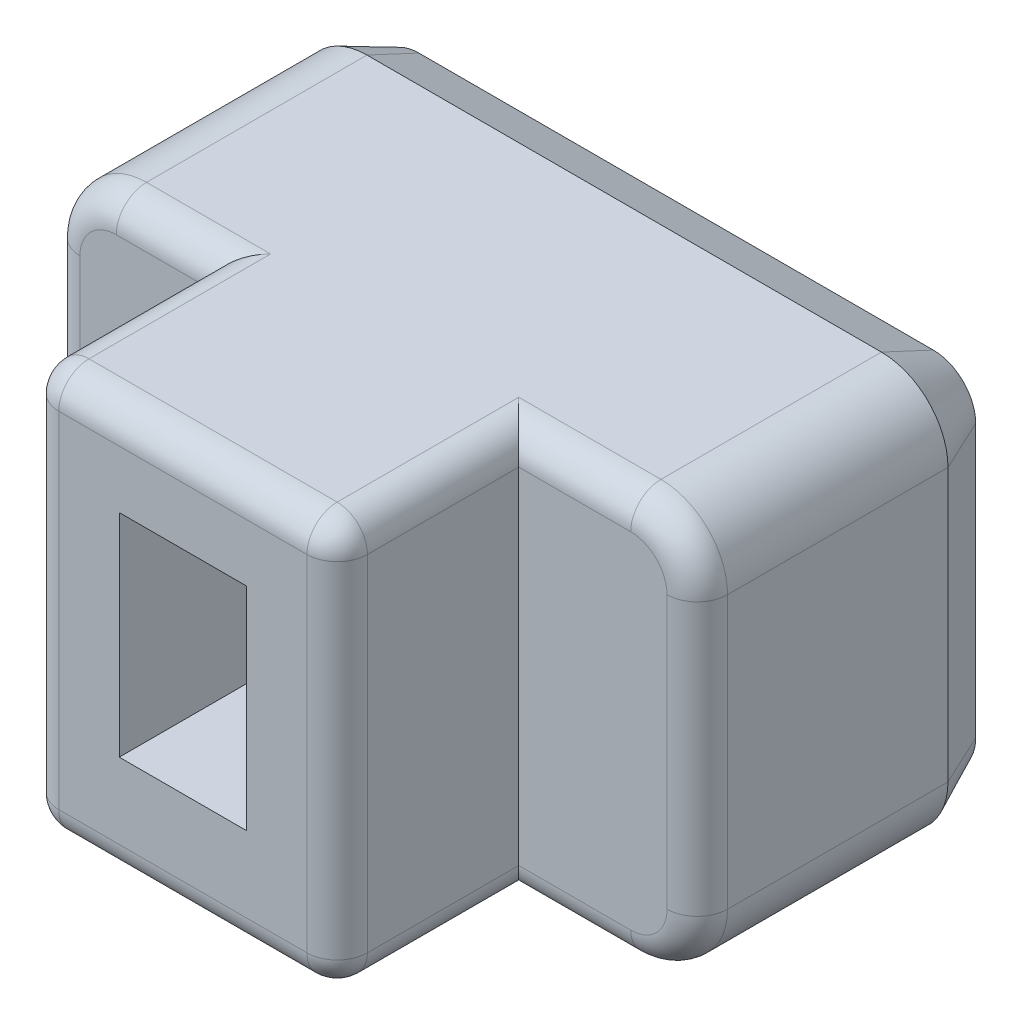
from build123d import *

# Parameters (mm, degrees)
BOSS_EXTRU_1_DEPTH      = 8
ESQUISSE3_W             = 2.1
ESQUISSE3_H             = 3.5
ENL_V_MAT_EXTRU_1_DEPTH = 3
ESQUISSE4_OUTSIDE_W     = 15.69
ESQUISSE4_OUTSIDE_H     = 11.69
ESQUISSE4_OUTSIDE_W_2   = 5.1
ESQUISSE4_OUTSIDE_H_2   = 6.7
ENL_V_MAT_EXTRU_2_DEPTH = 3
CONG_1_R                = 0.5
CHANFREIN1_SIZE         = 0.4
CHANFREIN1_SIZE2        = 0.857802768
ENL_V_MAT_EXTRU_3_DEPTH = 0.3
BOSS_EXTRU_2_START      = -0.2
BOSS_EXTRU_2_DEPTH      = 0.2
BOSS_EXTRU_2_2_DEPTH    = 0.2
BOSS_EXTRU_2_3_DEPTH    = 0.2


with BuildPart() as part:
    # Esquisse2 → Boss.-Extru.1 (new body)
    with BuildSketch(Plane.XY):
        with BuildLine():
            Line((1.1, 0), (9.6, 0))
            ThreePointArc((9.6, 0), (10.377817459, 0.322182541), (10.7, 1.1))
            Line((10.7, 1.1), (10.7, 5.6))
            ThreePointArc((10.7, 5.6), (10.377817459, 6.377817459), (9.6, 6.7))
            Line((9.6, 6.7), (1.1, 6.7))
            ThreePointArc((1.1, 6.7), (0.322182541, 6.377817459), (0, 5.6))
            Line((0, 5.6), (0, 1.1))
            ThreePointArc((0, 1.1), (0.322182541, 0.322182541), (1.1, 0))
        make_face()
    extrude(amount=BOSS_EXTRU_1_DEPTH)

    # Esquisse3 → Enlèv. mat.-Extru.1 (cut)
    with BuildSketch(Plane.XY.offset(8)):
        with Locations((5.2, 3.5)):
            Rectangle(ESQUISSE3_W, ESQUISSE3_H)
    extrude(amount=-ENL_V_MAT_EXTRU_1_DEPTH, mode=Mode.SUBTRACT)

    # Esquisse4 outside → Enlèv. mat.-Extru.2 (cut)
    with BuildSketch(Plane.XY.offset(8)):
        with Locations((5.35, 3.35)):
            Rectangle(ESQUISSE4_OUTSIDE_W, ESQUISSE4_OUTSIDE_H)
        with Locations((5.2, 3.35)):
            Rectangle(ESQUISSE4_OUTSIDE_W_2, ESQUISSE4_OUTSIDE_H_2, mode=Mode.SUBTRACT)
    extrude(amount=-ENL_V_MAT_EXTRU_2_DEPTH, mode=Mode.SUBTRACT)

    # Congé1
    cong_1_edges = [part.edges().sort_by_distance(p)[0] for p in [
        (8.675, 0, 5),
        (10.377817459, 0.322182541, 5),
        (10.7, 3.35, 5),
        (10.377817459, 6.377817459, 5),
        (1.875, 6.7, 5),
        (0.322182541, 6.377817459, 5),
        (1.875, 0, 5),
        (0.322182541, 0.322182541, 5),
        (7.75, 6.7, 6.5),
        (2.65, 6.7, 6.5),
        (7.75, 0, 6.5),
        (2.65, 0, 6.5),
        (2.65, 3.35, 8),
        (5.2, 6.7, 8),
        (7.75, 3.35, 8),
        (5.2, 0, 8),
        (8.675, 6.7, 5),
        (0, 3.35, 5),
    ]]
    fillet(cong_1_edges, radius=CONG_1_R)

    # Chanfrein1
    chanfrein1_edges = [part.edges().sort_by_distance(p)[0] for p in [
        (5.35, 0, 0),
        (10.377817459, 0.322182541, 0),
        (0.322182541, 0.322182541, 0),
        (10.7, 3.35, 0),
        (0, 3.35, 0),
        (10.377817459, 6.377817459, 0),
        (0.322182541, 6.377817459, 0),
        (5.35, 6.7, 0),
    ]]
    chanfrein1_side = [part.faces().sort_by_distance(p)[0] for p in [
        (5.35, 3.35, 0),
    ]]
    chamfer(chanfrein1_edges, length=CHANFREIN1_SIZE, length2=CHANFREIN1_SIZE2, reference=chanfrein1_side[0])

    # Esquisse5 → Enlèv. mat.-Extru.3 (cut)
    # profile 1 of 3: a face of its own
    with BuildSketch(Plane.XY.offset(0.2)):
        Polygon((0.715926417, 1.356639893), (1.023618725, 1.356639893), (1.023618725, 2.997665534), (2.613362315, 2.997665534), (2.613362315, 1.356639893), (2.921054623, 1.356639893), (2.921054623, 5.356639893), (2.613362315, 5.356639893), (2.613362315, 3.407921944), (1.023618725, 3.407921944), (1.023618725, 5.356639893), (0.715926417, 5.356639893), align=None)
    # profile 2 of 3: a face of its own
    with BuildSketch(Plane.XY.offset(0.2)):
        with BuildLine():
            Line((3.690285392, 5.356639893), (3.690285392, 1.356639893))
            Line((3.690285392, 1.356639893), (4.333714879, 1.356639893))
            add(Edge.make_bspline(
                [(4.333714879, 1.356639893), (4.389810624, 1.357141838), (4.498033773, 1.358110221), (4.654382412, 1.364341846), (4.798763625, 1.37522077), (4.931297353, 1.391439913), (5.05211199, 1.410690919), (5.160998907, 1.435700169), (5.258032382, 1.464338702), (5.317069978, 1.489157436), (5.344932828, 1.500870662)],
                knots=[0, 0, 0, 0, 1.309437096, 2.526241632, 3.651891148, 4.688159363, 5.642426799, 6.506028034, 7.294918487, 8, 8, 8, 8], degree=3))
            add(Edge.make_bspline(
                [(5.344932828, 1.500870662), (5.38188335, 1.518625889), (5.455730178, 1.55411029), (5.55990193, 1.61936032), (5.657506628, 1.694584532), (5.748885002, 1.779084136), (5.834797423, 1.872181645), (5.914792343, 1.974572822), (5.987222614, 2.087038482), (6.05386307, 2.207963954), (6.112417599, 2.336840098), (6.16529012, 2.471568229), (6.207714223, 2.613073796), (6.244545367, 2.759934319), (6.271046471, 2.913499831), (6.291211889, 3.07281956), (6.303437472, 3.238126311), (6.304918167, 3.350209277), (6.305670007, 3.407120662)],
                knots=[0, 0, 0, 0, 0.871458102, 1.741637522, 2.608639908, 3.489143415, 4.385702305, 5.30052474, 6.249139159, 7.228044385, 8.234696997, 9.258075304, 10.303960817, 11.374580795, 12.476736741, 13.616170212, 14.789583668, 16, 16, 16, 16], degree=3))
            add(Edge.make_bspline(
                [(6.305670007, 3.407120662), (6.305100941, 3.456552211), (6.303980157, 3.553908278), (6.29373894, 3.697427236), (6.279248456, 3.836625171), (6.256319482, 3.971000141), (6.228554537, 4.101357333), (6.194129789, 4.227120318), (6.153366616, 4.348396397), (6.105893915, 4.464235934), (6.054393254, 4.574372206), (5.99807055, 4.677327835), (5.93803716, 4.772997212), (5.873803073, 4.861138999), (5.806689047, 4.94228008), (5.735736847, 5.016026855), (5.660523391, 5.081519527), (5.580851635, 5.140249605), (5.495522666, 5.191945236), (5.402285921, 5.236158637), (5.301256284, 5.27383734), (5.191980842, 5.303721936), (5.075109728, 5.328190228), (4.949989625, 5.344261422), (4.81681544, 5.355184163), (4.725298575, 5.356145726), (4.678266161, 5.356639893)],
                knots=[0, 0, 0, 0, 1.230996608, 2.424463549, 3.582262823, 4.715295747, 5.817862929, 6.900767493, 7.961040225, 9.002445687, 10.017227083, 10.987759982, 11.923516021, 12.82835125, 13.702260399, 14.544397218, 15.374225883, 16.18320695, 17.006933457, 17.854961706, 18.749590543, 19.688981151, 20.674020178, 21.721168008, 22.828861015, 24, 24, 24, 24], degree=3))
            Line((4.678266161, 5.356639893), (3.690285392, 5.356639893))
        make_face()
        with BuildLine():
            Line((3.997977699, 4.946383482), (4.356150776, 4.946383482))
            add(Edge.make_bspline(
                [(4.356150776, 4.946383482), (4.407703929, 4.946103684), (4.506561014, 4.945567148), (4.64870714, 4.940758435), (4.778580721, 4.932924833), (4.896481153, 4.921995766), (5.002039128, 4.907553668), (5.095572153, 4.891268748), (5.176717248, 4.871198539), (5.225405676, 4.853039307), (5.247977699, 4.844620662)],
                knots=[0, 0, 0, 0, 1.371756857, 2.630447951, 3.784000471, 4.833481419, 5.780309705, 6.618141895, 7.359368634, 8, 8, 8, 8], degree=3))
            add(Edge.make_bspline(
                [(5.247977699, 4.844620662), (5.276531751, 4.831753671), (5.333250547, 4.806195118), (5.414129236, 4.759140296), (5.489919044, 4.704791963), (5.561286335, 4.643144214), (5.627804713, 4.574210889), (5.689176463, 4.497521308), (5.747780631, 4.41504435), (5.79880364, 4.324176383), (5.846843562, 4.228477805), (5.886323265, 4.125927778), (5.921056965, 4.018762735), (5.948616499, 3.906178935), (5.971727374, 3.788922324), (5.986089432, 3.665941572), (5.996296775, 3.537901555), (5.997411022, 3.450678674), (5.997977699, 3.40631938)],
                knots=[0, 0, 0, 0, 0.872870774, 1.733840824, 2.603942947, 3.469923535, 4.360066847, 5.27081542, 6.2067643, 7.177648912, 8.173548867, 9.190065718, 10.238176611, 11.312938644, 12.42011282, 13.568357395, 14.763329657, 16, 16, 16, 16], degree=3))
            add(Edge.make_bspline(
                [(5.997977699, 3.40631938), (5.997466745, 3.35955518), (5.996463937, 3.2677749), (5.985501603, 3.133005526), (5.969143678, 3.003432466), (5.944845945, 2.879092005), (5.914621755, 2.759685363), (5.877726418, 2.645278286), (5.833840338, 2.5361347), (5.782355063, 2.433067445), (5.725961261, 2.335988066), (5.663265507, 2.246902564), (5.595547876, 2.165386553), (5.522950064, 2.091203088), (5.443564897, 2.026437996), (5.360328314, 1.968014276), (5.27059782, 1.918870049), (5.207629076, 1.892419623), (5.175862315, 1.87907579)],
                knots=[0, 0, 0, 0, 1.215863483, 2.386276084, 3.514051247, 4.610658038, 5.67873613, 6.715526467, 7.734503913, 8.734748735, 9.709217586, 10.65154377, 11.564008312, 12.462834927, 13.345957941, 14.22456227, 15.104319012, 16, 16, 16, 16], degree=3))
            add(Edge.make_bspline(
                [(5.175862315, 1.87907579), (5.149828628, 1.869794129), (5.094485765, 1.850063012), (5.00355668, 1.828796606), (4.901194579, 1.809412), (4.787270395, 1.793679726), (4.661333372, 1.781915962), (4.523978642, 1.773378172), (4.374631072, 1.767491246), (4.271221065, 1.767099634), (4.217528981, 1.766896303)],
                knots=[0, 0, 0, 0, 0.683865251, 1.453772614, 2.308532226, 3.263444264, 4.299883334, 5.439701388, 6.670653156, 8, 8, 8, 8], degree=3))
            Line((4.217528981, 1.766896303), (3.997977699, 1.766896303))
            Line((3.997977699, 1.766896303), (3.997977699, 4.946383482))
        make_face(mode=Mode.SUBTRACT)
    # profile 3 of 3: a face of its own
    with BuildSketch(Plane.XY.offset(0.2)):
        with BuildLine():
            Line((9.844131546, 2.0393322), (9.604548212, 2.330998867))
            add(Edge.make_bspline(
                [(9.604548212, 2.330998867), (9.562468533, 2.278907424), (9.480489234, 2.177423286), (9.345191024, 2.04243905), (9.2045377, 1.926469116), (9.058028049, 1.831966442), (8.909379639, 1.758270045), (8.761697263, 1.704641886), (8.61572458, 1.670455077), (8.518449965, 1.666347218), (8.47073411, 1.6643322)],
                knots=[0, 0, 0, 0, 1.180687346, 2.300205755, 3.365101019, 4.391120667, 5.368907022, 6.285573214, 7.15902685, 8, 8, 8, 8], degree=3))
            add(Edge.make_bspline(
                [(8.47073411, 1.6643322), (8.441311044, 1.664789611), (8.382777414, 1.665699573), (8.295804066, 1.677936092), (8.20971172, 1.695212561), (8.124731037, 1.720144124), (8.040939415, 1.752487038), (7.958239891, 1.791975967), (7.876424164, 1.838368019), (7.796833735, 1.89228938), (7.719064075, 1.950862984), (7.64631239, 2.016356627), (7.576927083, 2.085914431), (7.512956719, 2.161443248), (7.453623296, 2.241975162), (7.398135957, 2.326846016), (7.347582293, 2.417201277), (7.285909441, 2.543743677), (7.222223916, 2.709257005), (7.166629426, 2.914308597), (7.132712518, 3.125011443), (7.128370709, 3.267307348), (7.126182828, 3.339011688)],
                knots=[0, 0, 0, 0, 0.742259079, 1.476634665, 2.213266877, 2.958002962, 3.709395258, 4.478551439, 5.269797051, 6.081496202, 6.904212888, 7.725740376, 8.55066496, 9.383025279, 10.221915722, 11.074809916, 11.941350438, 12.834049132, 14.627324618, 16.408718839, 18.19031726, 20, 20, 20, 20], degree=3))
            add(Edge.make_bspline(
                [(7.126182828, 3.339011688), (7.126856191, 3.375887521), (7.128199908, 3.449474369), (7.137259754, 3.559138392), (7.151679448, 3.667447062), (7.171463564, 3.774306788), (7.1983332, 3.879551989), (7.230278075, 3.983626061), (7.267837731, 4.086521691), (7.311936133, 4.1868994), (7.360617964, 4.284232973), (7.412964937, 4.377350791), (7.471210356, 4.464375902), (7.533904659, 4.545966301), (7.59989575, 4.623382471), (7.672001137, 4.693729893), (7.747184644, 4.759953857), (7.827144464, 4.81978209), (7.910411021, 4.873120988), (7.995078572, 4.920871588), (8.082285414, 4.960359806), (8.171649188, 4.992224673), (8.262758823, 5.018433487), (8.356219569, 5.035342444), (8.45117739, 5.047622318), (8.515297815, 5.04850309), (8.547657187, 5.048947585)],
                knots=[0, 0, 0, 0, 1.075840136, 2.146871707, 3.208192187, 4.262768225, 5.315499992, 6.375417725, 7.437996236, 8.509339603, 9.572260955, 10.612283221, 11.623770606, 12.62439315, 13.613325671, 14.588655471, 15.560711034, 16.534794804, 17.498852356, 18.444209562, 19.368388703, 20.287824717, 21.21052425, 22.130587493, 23.056571834, 24, 24, 24, 24], degree=3))
            add(Edge.make_bspline(
                [(8.547657187, 5.048947585), (8.586716054, 5.047881009), (8.663300956, 5.045789714), (8.775941257, 5.02893035), (8.884192565, 5.00327241), (8.987524214, 4.964672383), (9.086648255, 4.917095151), (9.180061713, 4.856396707), (9.269997417, 4.78715407), (9.353877552, 4.706737873), (9.430943171, 4.618197241), (9.501345882, 4.523090198), (9.563082062, 4.421580831), (9.615170305, 4.312804353), (9.660227877, 4.198615112), (9.696094919, 4.077357849), (9.724579204, 3.950234097), (9.735848788, 3.862631533), (9.741567443, 3.818178354)],
                knots=[0, 0, 0, 0, 0.992912374, 1.946858703, 2.890909988, 3.817172759, 4.74681697, 5.68148572, 6.64486633, 7.629846476, 8.631204397, 9.627086651, 10.635973685, 11.647669691, 12.690893319, 13.754703108, 14.860643121, 16, 16, 16, 16], degree=3))
            Line((9.741567443, 3.818178354), (8.767208469, 3.818178354))
            Line((8.767208469, 3.818178354), (8.767208469, 3.407921944))
            Line((8.767208469, 3.407921944), (10.049259751, 3.407921944))
            add(Edge.make_bspline(
                [(10.049259751, 3.407921944), (10.047828616, 3.484358386), (10.045031341, 3.633759917), (10.02462097, 3.851620046), (9.992588345, 4.057748989), (9.945422581, 4.251066014), (9.888584109, 4.433323915), (9.817121501, 4.602858281), (9.732436642, 4.760245857), (9.636099108, 4.904811467), (9.528857386, 5.03523215), (9.411594592, 5.148615374), (9.285807583, 5.245221727), (9.150707137, 5.323395178), (9.007154325, 5.384947585), (8.854717367, 5.427983412), (8.693600502, 5.454279437), (8.583282744, 5.457536885), (8.526823853, 5.459203995)],
                knots=[0, 0, 0, 0, 1.279806105, 2.501489936, 3.661075445, 4.769756154, 5.830628382, 6.854870993, 7.845435408, 8.819216976, 9.759534113, 10.667346308, 11.544905986, 12.408691644, 13.274351151, 14.153505069, 15.054992972, 16, 16, 16, 16], degree=3))
            add(Edge.make_bspline(
                [(8.526823853, 5.459203995), (8.492348241, 5.458550645), (8.424086934, 5.457257018), (8.322977467, 5.448078488), (8.224364828, 5.434160921), (8.128690746, 5.41283642), (8.035573995, 5.386853067), (7.945565988, 5.353538695), (7.858075715, 5.315000303), (7.772850741, 5.271196219), (7.69108846, 5.220159884), (7.61166992, 5.164256075), (7.535135372, 5.102119975), (7.461609709, 5.034072419), (7.390704807, 4.9599364), (7.322911099, 4.879620071), (7.256837905, 4.794157101), (7.216373103, 4.733494389), (7.195894366, 4.702793739)],
                knots=[0, 0, 0, 0, 1.032382545, 2.044105334, 3.038476821, 4.012827536, 4.97754274, 5.931586725, 6.884288403, 7.839538852, 8.798533035, 9.768407888, 10.746592774, 11.748528567, 12.766901797, 13.816738798, 14.895078446, 16, 16, 16, 16], degree=3))
            add(Edge.make_bspline(
                [(7.195894366, 4.702793739), (7.165719421, 4.653829886), (7.10532397, 4.555828248), (7.029119161, 4.400869833), (6.963438492, 4.24067296), (6.910982321, 4.074338302), (6.868952679, 3.902559204), (6.839608766, 3.724977686), (6.821428904, 3.541852102), (6.819478449, 3.417847268), (6.81849052, 3.355037329)],
                knots=[0, 0, 0, 0, 0.972045947, 1.945559608, 2.915893918, 3.89712903, 4.891732452, 5.90371772, 6.93820781, 8, 8, 8, 8], degree=3))
            add(Edge.make_bspline(
                [(6.81849052, 3.355037329), (6.819024228, 3.308007766), (6.820083889, 3.214631915), (6.831084708, 3.075866654), (6.847696002, 2.939744325), (6.870928265, 2.805953008), (6.901346934, 2.674925058), (6.938582651, 2.546129895), (6.981313703, 2.419566558), (7.032160391, 2.296586077), (7.087461905, 2.177806909), (7.148749715, 2.065333548), (7.214027676, 1.959076961), (7.286130294, 1.860426006), (7.361707415, 1.767242721), (7.443194742, 1.681374947), (7.528832536, 1.601457238), (7.620358238, 1.529702734), (7.715195679, 1.464854333), (7.813368193, 1.408244735), (7.914890963, 1.361091654), (8.019046423, 1.321192269), (8.127114091, 1.291912689), (8.237971518, 1.270382297), (8.351764396, 1.25591951), (8.428756195, 1.254693303), (8.467528981, 1.25407579)],
                knots=[0, 0, 0, 0, 1.139711699, 2.262864963, 3.37180397, 4.462757961, 5.55261649, 6.630409794, 7.711387132, 8.788577517, 9.854345975, 10.885638304, 11.891667971, 12.874559675, 13.845244002, 14.797818948, 15.7415531, 16.681861386, 17.61379728, 18.524396463, 19.425115267, 20.324530233, 21.224504218, 22.134850217, 23.060717449, 24, 24, 24, 24], degree=3))
            add(Edge.make_bspline(
                [(8.467528981, 1.25407579), (8.499065325, 1.254752724), (8.56199062, 1.256103427), (8.655400414, 1.265081688), (8.747424272, 1.279642912), (8.838262493, 1.299537037), (8.927631599, 1.325956969), (9.01552572, 1.358438176), (9.10224129, 1.395829339), (9.187458843, 1.440334865), (9.271724749, 1.490929539), (9.355453226, 1.54819969), (9.438751368, 1.612277687), (9.521338921, 1.683786197), (9.603136345, 1.762714733), (9.68456381, 1.848348233), (9.765934355, 1.940539682), (9.817720802, 2.005965479), (9.844131546, 2.0393322)],
                knots=[0, 0, 0, 0, 0.919647238, 1.834996262, 2.733959633, 3.635416665, 4.54488085, 5.449260826, 6.366695346, 7.296870797, 8.250651732, 9.231496765, 10.253508801, 11.31380595, 12.415577929, 13.567028811, 14.759200909, 16, 16, 16, 16], degree=3))
        make_face()
    extrude(amount=-ENL_V_MAT_EXTRU_3_DEPTH, mode=Mode.SUBTRACT)


with BuildPart() as body_2:
    # Esquisse5<3> → Boss.-Extru.2 (new body)
    with BuildSketch(Plane.XY.offset(0.2).offset(BOSS_EXTRU_2_START)):
        Polygon((0.715926417, 1.356639893), (1.023618725, 1.356639893), (1.023618725, 2.997665534), (2.613362315, 2.997665534), (2.613362315, 1.356639893), (2.921054623, 1.356639893), (2.921054623, 5.356639893), (2.613362315, 5.356639893), (2.613362315, 3.407921944), (1.023618725, 3.407921944), (1.023618725, 5.356639893), (0.715926417, 5.356639893), align=None)
    extrude(amount=-BOSS_EXTRU_2_DEPTH)


with BuildPart() as body_3:
    # Esquisse5<3> → Boss.-Extru.2 2 (new body)
    with BuildSketch(Plane.XY.offset(0.2).offset(BOSS_EXTRU_2_START)):
        with BuildLine():
            Line((3.690285392, 5.356639893), (3.690285392, 1.356639893))
            Line((3.690285392, 1.356639893), (4.333714879, 1.356639893))
            add(Edge.make_bspline(
                [(4.333714879, 1.356639893), (4.389810624, 1.357141838), (4.498033773, 1.358110221), (4.654382412, 1.364341846), (4.798763625, 1.37522077), (4.931297353, 1.391439913), (5.05211199, 1.410690919), (5.160998907, 1.435700169), (5.258032382, 1.464338702), (5.317069978, 1.489157436), (5.344932828, 1.500870662)],
                knots=[0, 0, 0, 0, 1.309437096, 2.526241632, 3.651891148, 4.688159363, 5.642426799, 6.506028034, 7.294918487, 8, 8, 8, 8], degree=3))
            add(Edge.make_bspline(
                [(5.344932828, 1.500870662), (5.38188335, 1.518625889), (5.455730178, 1.55411029), (5.55990193, 1.61936032), (5.657506628, 1.694584532), (5.748885002, 1.779084136), (5.834797423, 1.872181645), (5.914792343, 1.974572822), (5.987222614, 2.087038482), (6.05386307, 2.207963954), (6.112417599, 2.336840098), (6.16529012, 2.471568229), (6.207714223, 2.613073796), (6.244545367, 2.759934319), (6.271046471, 2.913499831), (6.291211889, 3.07281956), (6.303437472, 3.238126311), (6.304918167, 3.350209277), (6.305670007, 3.407120662)],
                knots=[0, 0, 0, 0, 0.871458102, 1.741637522, 2.608639908, 3.489143415, 4.385702305, 5.30052474, 6.249139159, 7.228044385, 8.234696997, 9.258075304, 10.303960817, 11.374580795, 12.476736741, 13.616170212, 14.789583668, 16, 16, 16, 16], degree=3))
            add(Edge.make_bspline(
                [(6.305670007, 3.407120662), (6.305100941, 3.456552211), (6.303980157, 3.553908278), (6.29373894, 3.697427236), (6.279248456, 3.836625171), (6.256319482, 3.971000141), (6.228554537, 4.101357333), (6.194129789, 4.227120318), (6.153366616, 4.348396397), (6.105893915, 4.464235934), (6.054393254, 4.574372206), (5.99807055, 4.677327835), (5.93803716, 4.772997212), (5.873803073, 4.861138999), (5.806689047, 4.94228008), (5.735736847, 5.016026855), (5.660523391, 5.081519527), (5.580851635, 5.140249605), (5.495522666, 5.191945236), (5.402285921, 5.236158637), (5.301256284, 5.27383734), (5.191980842, 5.303721936), (5.075109728, 5.328190228), (4.949989625, 5.344261422), (4.81681544, 5.355184163), (4.725298575, 5.356145726), (4.678266161, 5.356639893)],
                knots=[0, 0, 0, 0, 1.230996608, 2.424463549, 3.582262823, 4.715295747, 5.817862929, 6.900767493, 7.961040225, 9.002445687, 10.017227083, 10.987759982, 11.923516021, 12.82835125, 13.702260399, 14.544397218, 15.374225883, 16.18320695, 17.006933457, 17.854961706, 18.749590543, 19.688981151, 20.674020178, 21.721168008, 22.828861015, 24, 24, 24, 24], degree=3))
            Line((4.678266161, 5.356639893), (3.690285392, 5.356639893))
        make_face()
        with BuildLine():
            Line((3.997977699, 4.946383482), (4.356150776, 4.946383482))
            add(Edge.make_bspline(
                [(4.356150776, 4.946383482), (4.407703929, 4.946103684), (4.506561014, 4.945567148), (4.64870714, 4.940758435), (4.778580721, 4.932924833), (4.896481153, 4.921995766), (5.002039128, 4.907553668), (5.095572153, 4.891268748), (5.176717248, 4.871198539), (5.225405676, 4.853039307), (5.247977699, 4.844620662)],
                knots=[0, 0, 0, 0, 1.371756857, 2.630447951, 3.784000471, 4.833481419, 5.780309705, 6.618141895, 7.359368634, 8, 8, 8, 8], degree=3))
            add(Edge.make_bspline(
                [(5.247977699, 4.844620662), (5.276531751, 4.831753671), (5.333250547, 4.806195118), (5.414129236, 4.759140296), (5.489919044, 4.704791963), (5.561286335, 4.643144214), (5.627804713, 4.574210889), (5.689176463, 4.497521308), (5.747780631, 4.41504435), (5.79880364, 4.324176383), (5.846843562, 4.228477805), (5.886323265, 4.125927778), (5.921056965, 4.018762735), (5.948616499, 3.906178935), (5.971727374, 3.788922324), (5.986089432, 3.665941572), (5.996296775, 3.537901555), (5.997411022, 3.450678674), (5.997977699, 3.40631938)],
                knots=[0, 0, 0, 0, 0.872870774, 1.733840824, 2.603942947, 3.469923535, 4.360066847, 5.27081542, 6.2067643, 7.177648912, 8.173548867, 9.190065718, 10.238176611, 11.312938644, 12.42011282, 13.568357395, 14.763329657, 16, 16, 16, 16], degree=3))
            add(Edge.make_bspline(
                [(5.997977699, 3.40631938), (5.997466745, 3.35955518), (5.996463937, 3.2677749), (5.985501603, 3.133005526), (5.969143678, 3.003432466), (5.944845945, 2.879092005), (5.914621755, 2.759685363), (5.877726418, 2.645278286), (5.833840338, 2.5361347), (5.782355063, 2.433067445), (5.725961261, 2.335988066), (5.663265507, 2.246902564), (5.595547876, 2.165386553), (5.522950064, 2.091203088), (5.443564897, 2.026437996), (5.360328314, 1.968014276), (5.27059782, 1.918870049), (5.207629076, 1.892419623), (5.175862315, 1.87907579)],
                knots=[0, 0, 0, 0, 1.215863483, 2.386276084, 3.514051247, 4.610658038, 5.67873613, 6.715526467, 7.734503913, 8.734748735, 9.709217586, 10.65154377, 11.564008312, 12.462834927, 13.345957941, 14.22456227, 15.104319012, 16, 16, 16, 16], degree=3))
            add(Edge.make_bspline(
                [(5.175862315, 1.87907579), (5.149828628, 1.869794129), (5.094485765, 1.850063012), (5.00355668, 1.828796606), (4.901194579, 1.809412), (4.787270395, 1.793679726), (4.661333372, 1.781915962), (4.523978642, 1.773378172), (4.374631072, 1.767491246), (4.271221065, 1.767099634), (4.217528981, 1.766896303)],
                knots=[0, 0, 0, 0, 0.683865251, 1.453772614, 2.308532226, 3.263444264, 4.299883334, 5.439701388, 6.670653156, 8, 8, 8, 8], degree=3))
            Line((4.217528981, 1.766896303), (3.997977699, 1.766896303))
            Line((3.997977699, 1.766896303), (3.997977699, 4.946383482))
        make_face(mode=Mode.SUBTRACT)
    extrude(amount=-BOSS_EXTRU_2_2_DEPTH)


with BuildPart() as body_4:
    # Esquisse5<3> → Boss.-Extru.2 3 (new body)
    with BuildSketch(Plane.XY.offset(0.2).offset(BOSS_EXTRU_2_START)):
        with BuildLine():
            Line((9.844131546, 2.0393322), (9.604548212, 2.330998867))
            add(Edge.make_bspline(
                [(9.604548212, 2.330998867), (9.562468533, 2.278907424), (9.480489234, 2.177423286), (9.345191024, 2.04243905), (9.2045377, 1.926469116), (9.058028049, 1.831966442), (8.909379639, 1.758270045), (8.761697263, 1.704641886), (8.61572458, 1.670455077), (8.518449965, 1.666347218), (8.47073411, 1.6643322)],
                knots=[0, 0, 0, 0, 1.180687346, 2.300205755, 3.365101019, 4.391120667, 5.368907022, 6.285573214, 7.15902685, 8, 8, 8, 8], degree=3))
            add(Edge.make_bspline(
                [(8.47073411, 1.6643322), (8.441311044, 1.664789611), (8.382777414, 1.665699573), (8.295804066, 1.677936092), (8.20971172, 1.695212561), (8.124731037, 1.720144124), (8.040939415, 1.752487038), (7.958239891, 1.791975967), (7.876424164, 1.838368019), (7.796833735, 1.89228938), (7.719064075, 1.950862984), (7.64631239, 2.016356627), (7.576927083, 2.085914431), (7.512956719, 2.161443248), (7.453623296, 2.241975162), (7.398135957, 2.326846016), (7.347582293, 2.417201277), (7.285909441, 2.543743677), (7.222223916, 2.709257005), (7.166629426, 2.914308597), (7.132712518, 3.125011443), (7.128370709, 3.267307348), (7.126182828, 3.339011688)],
                knots=[0, 0, 0, 0, 0.742259079, 1.476634665, 2.213266877, 2.958002962, 3.709395258, 4.478551439, 5.269797051, 6.081496202, 6.904212888, 7.725740376, 8.55066496, 9.383025279, 10.221915722, 11.074809916, 11.941350438, 12.834049132, 14.627324618, 16.408718839, 18.19031726, 20, 20, 20, 20], degree=3))
            add(Edge.make_bspline(
                [(7.126182828, 3.339011688), (7.126856191, 3.375887521), (7.128199908, 3.449474369), (7.137259754, 3.559138392), (7.151679448, 3.667447062), (7.171463564, 3.774306788), (7.1983332, 3.879551989), (7.230278075, 3.983626061), (7.267837731, 4.086521691), (7.311936133, 4.1868994), (7.360617964, 4.284232973), (7.412964937, 4.377350791), (7.471210356, 4.464375902), (7.533904659, 4.545966301), (7.59989575, 4.623382471), (7.672001137, 4.693729893), (7.747184644, 4.759953857), (7.827144464, 4.81978209), (7.910411021, 4.873120988), (7.995078572, 4.920871588), (8.082285414, 4.960359806), (8.171649188, 4.992224673), (8.262758823, 5.018433487), (8.356219569, 5.035342444), (8.45117739, 5.047622318), (8.515297815, 5.04850309), (8.547657187, 5.048947585)],
                knots=[0, 0, 0, 0, 1.075840136, 2.146871707, 3.208192187, 4.262768225, 5.315499992, 6.375417725, 7.437996236, 8.509339603, 9.572260955, 10.612283221, 11.623770606, 12.62439315, 13.613325671, 14.588655471, 15.560711034, 16.534794804, 17.498852356, 18.444209562, 19.368388703, 20.287824717, 21.21052425, 22.130587493, 23.056571834, 24, 24, 24, 24], degree=3))
            add(Edge.make_bspline(
                [(8.547657187, 5.048947585), (8.586716054, 5.047881009), (8.663300956, 5.045789714), (8.775941257, 5.02893035), (8.884192565, 5.00327241), (8.987524214, 4.964672383), (9.086648255, 4.917095151), (9.180061713, 4.856396707), (9.269997417, 4.78715407), (9.353877552, 4.706737873), (9.430943171, 4.618197241), (9.501345882, 4.523090198), (9.563082062, 4.421580831), (9.615170305, 4.312804353), (9.660227877, 4.198615112), (9.696094919, 4.077357849), (9.724579204, 3.950234097), (9.735848788, 3.862631533), (9.741567443, 3.818178354)],
                knots=[0, 0, 0, 0, 0.992912374, 1.946858703, 2.890909988, 3.817172759, 4.74681697, 5.68148572, 6.64486633, 7.629846476, 8.631204397, 9.627086651, 10.635973685, 11.647669691, 12.690893319, 13.754703108, 14.860643121, 16, 16, 16, 16], degree=3))
            Line((9.741567443, 3.818178354), (8.767208469, 3.818178354))
            Line((8.767208469, 3.818178354), (8.767208469, 3.407921944))
            Line((8.767208469, 3.407921944), (10.049259751, 3.407921944))
            add(Edge.make_bspline(
                [(10.049259751, 3.407921944), (10.047828616, 3.484358386), (10.045031341, 3.633759917), (10.02462097, 3.851620046), (9.992588345, 4.057748989), (9.945422581, 4.251066014), (9.888584109, 4.433323915), (9.817121501, 4.602858281), (9.732436642, 4.760245857), (9.636099108, 4.904811467), (9.528857386, 5.03523215), (9.411594592, 5.148615374), (9.285807583, 5.245221727), (9.150707137, 5.323395178), (9.007154325, 5.384947585), (8.854717367, 5.427983412), (8.693600502, 5.454279437), (8.583282744, 5.457536885), (8.526823853, 5.459203995)],
                knots=[0, 0, 0, 0, 1.279806105, 2.501489936, 3.661075445, 4.769756154, 5.830628382, 6.854870993, 7.845435408, 8.819216976, 9.759534113, 10.667346308, 11.544905986, 12.408691644, 13.274351151, 14.153505069, 15.054992972, 16, 16, 16, 16], degree=3))
            add(Edge.make_bspline(
                [(8.526823853, 5.459203995), (8.492348241, 5.458550645), (8.424086934, 5.457257018), (8.322977467, 5.448078488), (8.224364828, 5.434160921), (8.128690746, 5.41283642), (8.035573995, 5.386853067), (7.945565988, 5.353538695), (7.858075715, 5.315000303), (7.772850741, 5.271196219), (7.69108846, 5.220159884), (7.61166992, 5.164256075), (7.535135372, 5.102119975), (7.461609709, 5.034072419), (7.390704807, 4.9599364), (7.322911099, 4.879620071), (7.256837905, 4.794157101), (7.216373103, 4.733494389), (7.195894366, 4.702793739)],
                knots=[0, 0, 0, 0, 1.032382545, 2.044105334, 3.038476821, 4.012827536, 4.97754274, 5.931586725, 6.884288403, 7.839538852, 8.798533035, 9.768407888, 10.746592774, 11.748528567, 12.766901797, 13.816738798, 14.895078446, 16, 16, 16, 16], degree=3))
            add(Edge.make_bspline(
                [(7.195894366, 4.702793739), (7.165719421, 4.653829886), (7.10532397, 4.555828248), (7.029119161, 4.400869833), (6.963438492, 4.24067296), (6.910982321, 4.074338302), (6.868952679, 3.902559204), (6.839608766, 3.724977686), (6.821428904, 3.541852102), (6.819478449, 3.417847268), (6.81849052, 3.355037329)],
                knots=[0, 0, 0, 0, 0.972045947, 1.945559608, 2.915893918, 3.89712903, 4.891732452, 5.90371772, 6.93820781, 8, 8, 8, 8], degree=3))
            add(Edge.make_bspline(
                [(6.81849052, 3.355037329), (6.819024228, 3.308007766), (6.820083889, 3.214631915), (6.831084708, 3.075866654), (6.847696002, 2.939744325), (6.870928265, 2.805953008), (6.901346934, 2.674925058), (6.938582651, 2.546129895), (6.981313703, 2.419566558), (7.032160391, 2.296586077), (7.087461905, 2.177806909), (7.148749715, 2.065333548), (7.214027676, 1.959076961), (7.286130294, 1.860426006), (7.361707415, 1.767242721), (7.443194742, 1.681374947), (7.528832536, 1.601457238), (7.620358238, 1.529702734), (7.715195679, 1.464854333), (7.813368193, 1.408244735), (7.914890963, 1.361091654), (8.019046423, 1.321192269), (8.127114091, 1.291912689), (8.237971518, 1.270382297), (8.351764396, 1.25591951), (8.428756195, 1.254693303), (8.467528981, 1.25407579)],
                knots=[0, 0, 0, 0, 1.139711699, 2.262864963, 3.37180397, 4.462757961, 5.55261649, 6.630409794, 7.711387132, 8.788577517, 9.854345975, 10.885638304, 11.891667971, 12.874559675, 13.845244002, 14.797818948, 15.7415531, 16.681861386, 17.61379728, 18.524396463, 19.425115267, 20.324530233, 21.224504218, 22.134850217, 23.060717449, 24, 24, 24, 24], degree=3))
            add(Edge.make_bspline(
                [(8.467528981, 1.25407579), (8.499065325, 1.254752724), (8.56199062, 1.256103427), (8.655400414, 1.265081688), (8.747424272, 1.279642912), (8.838262493, 1.299537037), (8.927631599, 1.325956969), (9.01552572, 1.358438176), (9.10224129, 1.395829339), (9.187458843, 1.440334865), (9.271724749, 1.490929539), (9.355453226, 1.54819969), (9.438751368, 1.612277687), (9.521338921, 1.683786197), (9.603136345, 1.762714733), (9.68456381, 1.848348233), (9.765934355, 1.940539682), (9.817720802, 2.005965479), (9.844131546, 2.0393322)],
                knots=[0, 0, 0, 0, 0.919647238, 1.834996262, 2.733959633, 3.635416665, 4.54488085, 5.449260826, 6.366695346, 7.296870797, 8.250651732, 9.231496765, 10.253508801, 11.31380595, 12.415577929, 13.567028811, 14.759200909, 16, 16, 16, 16], degree=3))
        make_face()
    extrude(amount=-BOSS_EXTRU_2_3_DEPTH)


solid = Compound([part.part, body_2.part, body_3.part, body_4.part])
